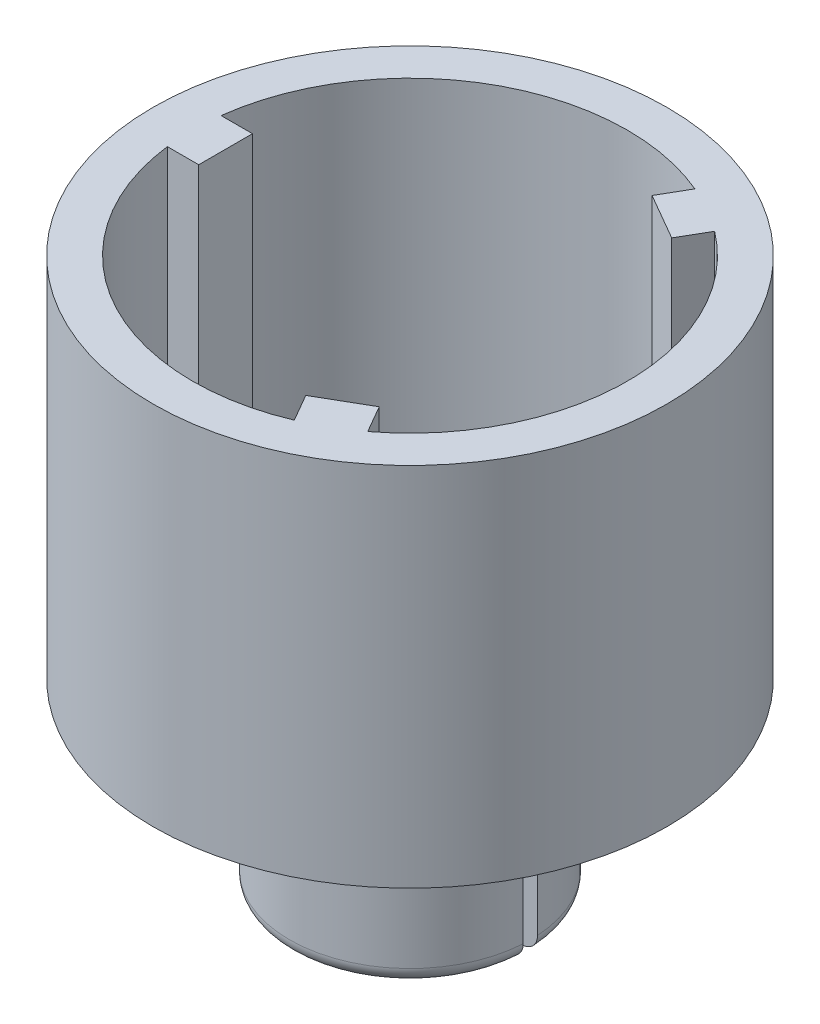
from build123d import *

# Parameters (mm, degrees)
SKETCH1_R           = 32.5
BOSS_EXTRUDE1_DEPTH = 46.3
SKETCH2_R           = 27.5
CUT_EXTRUDE1_DEPTH  = 40
SKETCH3_R           = 19.5
BOSS_EXTRUDE2_DEPTH = 7
SKETCH4_R           = 15.25
BOSS_EXTRUDE3_DEPTH = 16
FILLET1_R           = 5
SKETCH7_W           = 66.193685288
SKETCH7_H           = 1.806726502
CUT_EXTRUDE2_DEPTH  = 16
FILLET2_R           = 2
SKETCH9_W           = 9
SKETCH9_H           = 6.8
BOSS_EXTRUDE4_DEPTH = 40
SKETCH8_R           = 7.5
CUT_EXTRUDE3_DEPTH  = 61.930288035
CIRPATTERN1_COUNT   = 3


with BuildPart() as part:
    # Sketch1 → Boss-Extrude1 (new body)
    with BuildSketch(Plane(origin=(0, 0, 0), x_dir=(1, 0, 0), z_dir=(0, 1, 0))):
        with Locations(Location((0, 0, 0), (0, 0, 270))):
            Circle(SKETCH1_R)
    extrude(amount=BOSS_EXTRUDE1_DEPTH)

    # Sketch2 → Cut-Extrude1 (cut)
    with BuildSketch(Plane(origin=(0, 46.3, 0), x_dir=(1, 0, 0), z_dir=(0, 1, 0))):
        with Locations(Location((0, 0, 0), (0, 0, 270))):
            Circle(SKETCH2_R)
    extrude(amount=-CUT_EXTRUDE1_DEPTH, mode=Mode.SUBTRACT)

    # Sketch3 → Boss-Extrude2 (add)
    with BuildSketch(Plane.XZ):
        with Locations(Location((0, 0, 0), (0, 0, 270))):
            Circle(SKETCH3_R)
    extrude(amount=BOSS_EXTRUDE2_DEPTH)

    # Sketch4 → Boss-Extrude3 (add)
    with BuildSketch(Plane.XZ.offset(7)):
        with Locations(Location((0, 0, 0), (0, 0, 270))):
            Circle(SKETCH4_R)
    extrude(amount=BOSS_EXTRUDE3_DEPTH)

    # Fillet1
    fillet1_edges = [part.edges().sort_by_distance(p)[0] for p in [
        (0, 0, 19.5),
    ]]
    fillet(fillet1_edges, radius=FILLET1_R)

    # Sketch7 → Cut-Extrude2 (cut)
    with BuildSketch(Plane.XZ.offset(23)):
        Rectangle(SKETCH7_W, SKETCH7_H)
    extrude(amount=-CUT_EXTRUDE2_DEPTH, mode=Mode.SUBTRACT)

    # Fillet2
    fillet2_edges = [part.edges().sort_by_distance(p)[0] for p in [
        (0, -23, 15.25),
        (0, -23, -15.25),
    ]]
    fillet(fillet2_edges, radius=FILLET2_R)

    # Sketch9 → Boss-Extrude4 (add)
    with BuildSketch(Plane(origin=(0, 46.3, 0), x_dir=(1, 0, 0), z_dir=(0, 1, 0))):
        with Locations((-27.821664561, 0)):
            Rectangle(SKETCH9_W, SKETCH9_H)
    boss_extrude4 = extrude(amount=-BOSS_EXTRUDE4_DEPTH)

    # Sketch8 → Cut-Extrude3 (cut, through all)
    with BuildSketch(Plane(origin=(0, 6.3, 0), x_dir=(1, 0, 0), z_dir=(0, 1, 0))):
        with Locations(Location((0, 0, 0), (0, 0, 270))):
            Circle(SKETCH8_R)
    extrude(amount=-CUT_EXTRUDE3_DEPTH, mode=Mode.SUBTRACT)

    # CirPattern1: Boss-Extrude4 ×3 about axis
    cirpattern1_axis = Axis((0, 0, 0), (0, 1, 0))
    for i in range(1, CIRPATTERN1_COUNT):
        add(boss_extrude4.rotate(cirpattern1_axis, i * 360 / CIRPATTERN1_COUNT))


solid = part.part
